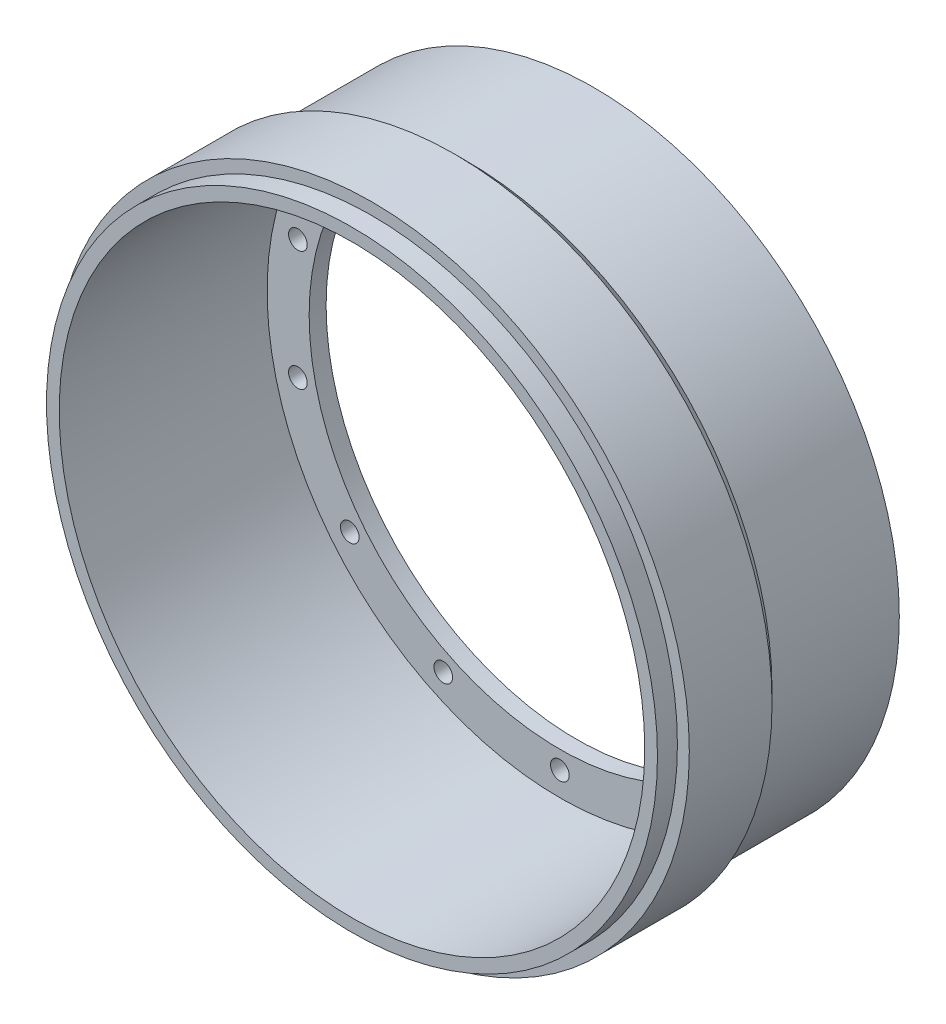
from build123d import *

# Parameters (mm, degrees)
ESQUISSE2_R             = 1.1
ENL_V_MAT_EXTRU_1_DEPTH = 59.29039372


with BuildPart() as part:
    # Esquisse1 → Révolution1 (revolve)
    with BuildSketch(Plane(origin=(0, 0, 0), x_dir=(0, 0, -1), z_dir=(1, 0, 0)), mode=Mode.PRIVATE) as r_volution1_sk:
        Polygon((0, 34.5), (0, 36), (-15, 36), (-16.4, 37.4), (-26.15, 37.4), (-26.15, 36), (-28.5, 36), (-28.5, 34.5), (-4, 34.5), (-4, 29.55), (-2, 29.55), (-2, 34.5), align=None)
    revolve(r_volution1_sk.sketch.rotate(Axis((0, 0, 14.835870703), (0, 0, -1)), 90), axis=Axis((0, 0, 14.835870703), (0, 0, -1)))

    # Esquisse2 → Enlèv. mat.-Extru.1 (cut, through all)
    with BuildSketch(Plane.XY.offset(4)):
        with Locations((0, 31.67)):
            Circle(ESQUISSE2_R)
        with Locations((13.741098018, 28.533684046)):
            Circle(ESQUISSE2_R)
        with Locations((24.76060305, 19.745922025)):
            Circle(ESQUISSE2_R)
        with Locations((30.875966979, 7.047237978)):
            Circle(ESQUISSE2_R)
        with Locations((30.875966979, -7.047237978)):
            Circle(ESQUISSE2_R)
        with Locations((24.76060305, -19.745922025)):
            Circle(ESQUISSE2_R)
        with Locations((13.741098018, -28.533684046)):
            Circle(ESQUISSE2_R)
        with Locations((0, -31.67)):
            Circle(ESQUISSE2_R)
        with Locations((-13.741098018, -28.533684046)):
            Circle(ESQUISSE2_R)
        with Locations((-24.76060305, -19.745922025)):
            Circle(ESQUISSE2_R)
        with Locations((-30.875966979, -7.047237978)):
            Circle(ESQUISSE2_R)
        with Locations((-30.875966979, 7.047237978)):
            Circle(ESQUISSE2_R)
        with Locations((-24.76060305, 19.745922025)):
            Circle(ESQUISSE2_R)
        with Locations((-13.741098018, 28.533684046)):
            Circle(ESQUISSE2_R)
    extrude(amount=-ENL_V_MAT_EXTRU_1_DEPTH, mode=Mode.SUBTRACT)


solid = part.part
